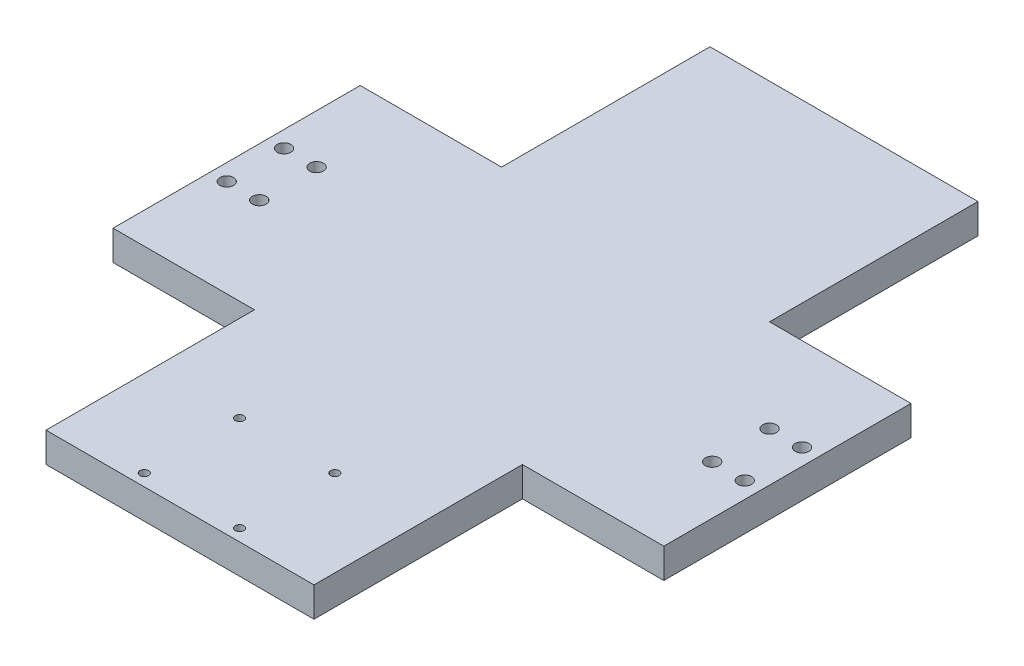
from build123d import *

# Parameters (mm, degrees)
EXTRUDE_2_DEPTH     = 10
SKETCH_4_R          = 1.45
CUT_EXTRUDE_1_DEPTH = 263.163594727
SKETCH_6_R          = 2.3
CUT_EXTRUDE_3_DEPTH = 4.5
SKETCH_11_R         = 1.45
CUT_EXTRUDE_4_DEPTH = 6.5
SKETCH_12_R         = 1.45
CUT_EXTRUDE_5_DEPTH = 10


with BuildPart() as part:
    # 草图2 → 凸台-拉伸2 (new body)
    with BuildSketch(Plane(origin=(0, 0, 0), x_dir=(1, 0, 0), z_dir=(0, 1, 0))):
        Polygon((0, 223), (0, 153), (-47.48, 153), (-47.48, 70), (0, 70), (0, 0), (90, 0), (90, 70), (137.48, 70), (137.48, 153), (90, 153), (90, 223), align=None)
    extrude(amount=EXTRUDE_2_DEPTH)

    # 草图4 → 切除-拉伸1 (cut, through all)
    with BuildSketch(Plane(origin=(0, 10, 0), x_dir=(1, 0, 0), z_dir=(0, 1, 0))):
        with Locations(Location((-41.98, 121.93, 0), (0, 0, 270))):
            Circle(SKETCH_4_R)
        with Locations(Location((-41.98, 102.68, 0), (0, 0, 270))):
            Circle(SKETCH_4_R)
        with Locations(Location((-31.06, 102.68, 0), (0, 0, 270))):
            Circle(SKETCH_4_R)
        with Locations(Location((-31.06, 121.93, 0), (0, 0, 270))):
            Circle(SKETCH_4_R)
    cut_extrude_1 = extrude(amount=-CUT_EXTRUDE_1_DEPTH, mode=Mode.SUBTRACT)

    # 镜向1: 切除-拉伸1 across plane
    add(cut_extrude_1.mirror(Plane(origin=(45, 0, 0), x_dir=(0, 0, 1), z_dir=(1, 0, 0))), mode=Mode.SUBTRACT)

    # 草图6 → 切除-拉伸3 (cut)
    with BuildSketch(Plane(origin=(0, 10, 0), x_dir=(1, 0, 0), z_dir=(0, 1, 0))):
        with Locations(Location((-41.98, 121.93, 0), (0, 0, 270))):
            Circle(SKETCH_6_R)
        with Locations(Location((-31.06, 121.93, 0), (0, 0, 270))):
            Circle(SKETCH_6_R)
        with Locations(Location((-41.98, 102.68, 0), (0, 0, 270))):
            Circle(SKETCH_6_R)
        with Locations(Location((-31.06, 102.68, 0), (0, 0, 270))):
            Circle(SKETCH_6_R)
    cut_extrude_3 = extrude(amount=-CUT_EXTRUDE_3_DEPTH, mode=Mode.SUBTRACT)

    # 镜向3: 切除-拉伸3 across plane
    add(cut_extrude_3.mirror(Plane(origin=(45, 0, 0), x_dir=(0, 0, 1), z_dir=(1, 0, 0))), mode=Mode.SUBTRACT)

    # 草图11 → 切除-拉伸4 (cut)
    with BuildSketch(Plane.XZ):
        with Locations(Location((33.98, -96.5, 0), (0, 0, 270))):
            Circle(SKETCH_11_R)
        with Locations(Location((13.98, -96.5, 0), (0, 0, 270))):
            Circle(SKETCH_11_R)
        with Locations(Location((33.98, -126.5, 0), (0, 0, 270))):
            Circle(SKETCH_11_R)
        with Locations(Location((13.98, -126.5, 0), (0, 0, 270))):
            Circle(SKETCH_11_R)
    cut_extrude_4 = extrude(amount=-CUT_EXTRUDE_4_DEPTH, mode=Mode.SUBTRACT)

    # 镜向4: 切除-拉伸4 across plane
    add(cut_extrude_4.mirror(Plane(origin=(45, 0, 0), x_dir=(0, 0, 1), z_dir=(1, 0, 0))), mode=Mode.SUBTRACT)

    # 草图12 → 切除-拉伸5 (cut)
    with BuildSketch(Plane(origin=(0, 10, 0), x_dir=(1, 0, 0), z_dir=(0, 1, 0))):
        with Locations(Location((61, 36, 0), (0, 0, 270))):
            Circle(SKETCH_12_R)
        with Locations(Location((29, 36, 0), (0, 0, 270))):
            Circle(SKETCH_12_R)
        with Locations(Location((29, 4, 0), (0, 0, 270))):
            Circle(SKETCH_12_R)
        with Locations(Location((61, 4, 0), (0, 0, 270))):
            Circle(SKETCH_12_R)
    extrude(amount=-CUT_EXTRUDE_5_DEPTH, mode=Mode.SUBTRACT)


solid = part.part
